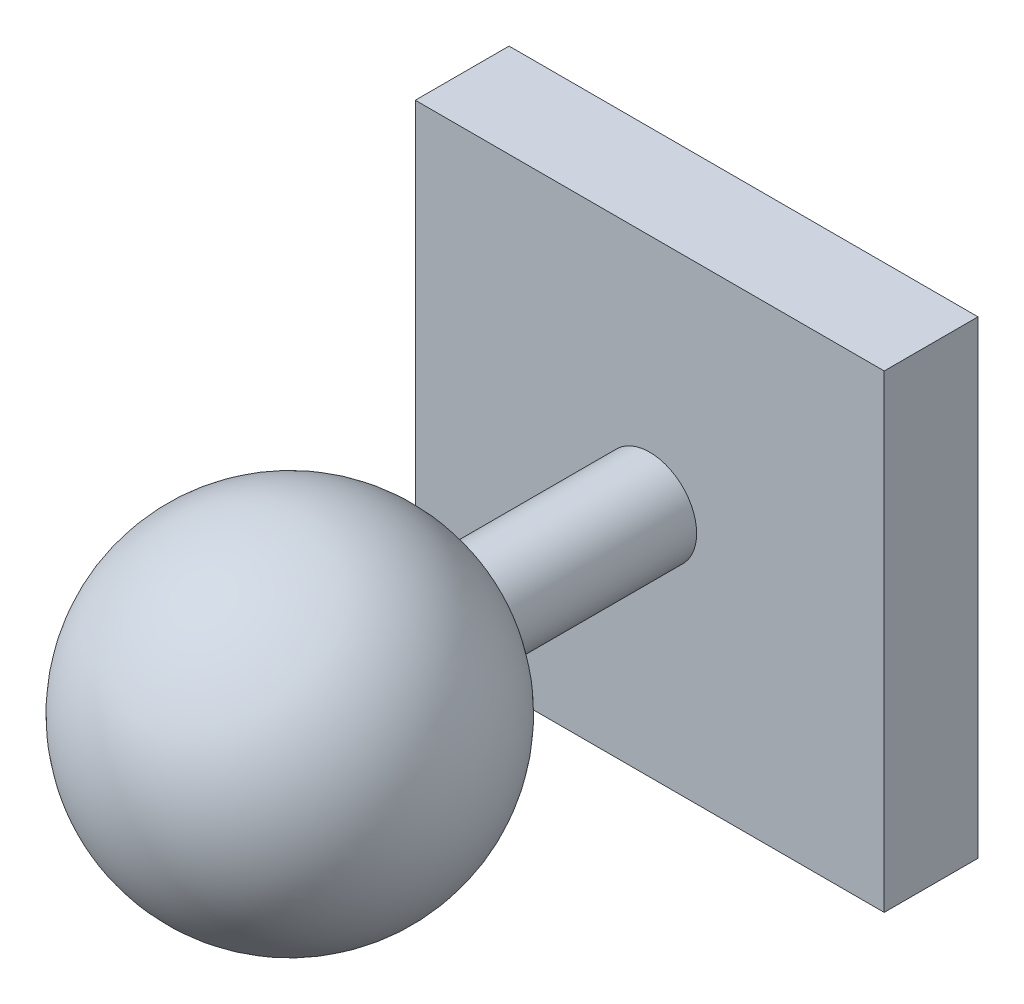
from build123d import *

# Parameters (mm, degrees)
SKETCH_1_W          = 50
SKETCH_1_H          = 50
EXTRUDE_1_DEPTH     = 10
SKETCH_2_R          = 5
EXTRUDE_2_DEPTH     = 20
SKETCH_5_R          = 5
CUT_EXTRUDE_3_DEPTH = 5


with BuildPart() as part:
    # 草图1 → 凸台-拉伸1 (new body)
    with BuildSketch(Plane.XY):
        Rectangle(SKETCH_1_W, SKETCH_1_H)
    extrude(amount=EXTRUDE_1_DEPTH)

    # 草图2 → 凸台-拉伸2 (add)
    with BuildSketch(Plane.XY.offset(10)):
        Circle(SKETCH_2_R)
    extrude(amount=EXTRUDE_2_DEPTH)

    # 草图5 → 切除-拉伸3 (cut)
    with BuildSketch(Plane(origin=(0, 0, 0), x_dir=(-1, 0, 0), z_dir=(0, 0, -1))):
        with Locations(Location((0, 0, 0), (0, 0, 180))):
            Circle(SKETCH_5_R)
    extrude(amount=-CUT_EXTRUDE_3_DEPTH, mode=Mode.SUBTRACT)


with BuildPart() as body_2:
    # 草图4 → 旋转16 (revolve)
    with BuildSketch(Plane(origin=(0, 0, 0), x_dir=(1, 0, 0), z_dir=(0, 1, 0))):
        with BuildLine():
            Line((0, -30), (0, -66.766135568))
            ThreePointArc((0, -66.766135568), (-18.383067784, -48.383067784), (0, -30))
        make_face()
    revolve(axis=Axis((0, 0, 30), (0, 0, 1)))


solid = Compound([part.part, body_2.part])
